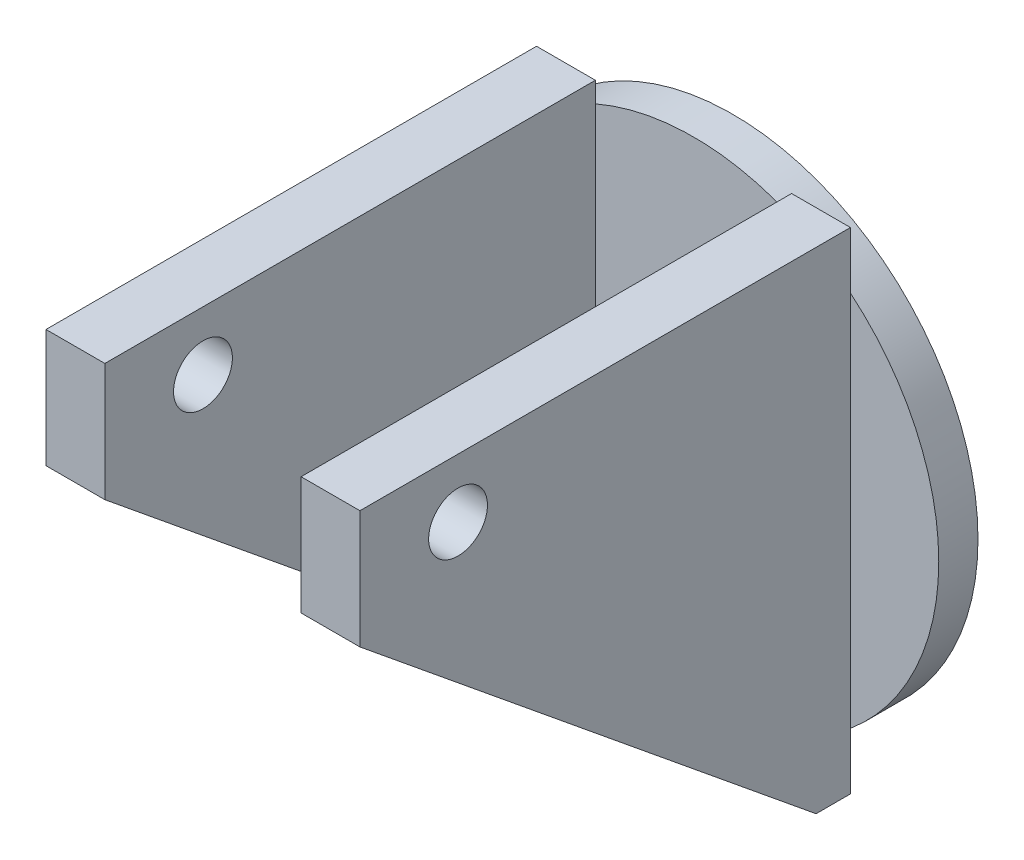
from build123d import *

# Parameters (mm, degrees)
SKETCH1_R           = 12.5
BOSS_EXTRUDE1_DEPTH = 2
SKETCH2_R           = 2
BOSS_EXTRUDE2_DEPTH = 1
SKETCH3_W           = 3
SKETCH3_H           = 25
BOSS_EXTRUDE3_DEPTH = 25
SKETCH5_R           = 1.5
CUT_EXTRUDE1_DEPTH  = 37.13170353
CUT_EXTRUDE2_DEPTH  = 37.13170353


with BuildPart() as part:
    # Sketch1 → Boss-Extrude1 (new body)
    with BuildSketch(Plane.XY):
        Circle(SKETCH1_R)
    extrude(amount=BOSS_EXTRUDE1_DEPTH)

    # Sketch2 → Boss-Extrude2 (add)
    with BuildSketch(Plane(origin=(0, 0, 0), x_dir=(-1, 0, 0), z_dir=(0, 0, -1))):
        Circle(SKETCH2_R)
    extrude(amount=BOSS_EXTRUDE2_DEPTH)

    # Sketch3 → Boss-Extrude3 (add)
    with BuildSketch(Plane.XY.offset(2)):
        with Locations((-6.5, 0)):
            Rectangle(SKETCH3_W, SKETCH3_H)
    boss_extrude3 = extrude(amount=BOSS_EXTRUDE3_DEPTH)

    # Mirror1: Boss-Extrude3 across plane
    add(boss_extrude3.mirror(Plane(origin=(0, 0, 0), x_dir=(0, 0, 1), z_dir=(1, 0, 0))))

    # Sketch5 → Cut-Extrude1 (cut, through all)
    with BuildSketch(Plane.ZY.offset(8)):
        with Locations(Location((22, 9.5, 0), (0, 0, 270))):
            Circle(SKETCH5_R)
    extrude(amount=-CUT_EXTRUDE1_DEPTH, mode=Mode.SUBTRACT)

    # Sketch6 → Cut-Extrude2 (cut, through all)
    with BuildSketch(Plane(origin=(8, 0, 0), x_dir=(0, 0, -1), z_dir=(1, 0, 0))):
        Polygon((-27, 6.485501453), (-3.7517805, -12.5), (-27, -12.5), align=None)
    extrude(amount=-CUT_EXTRUDE2_DEPTH, mode=Mode.SUBTRACT)


solid = part.part
